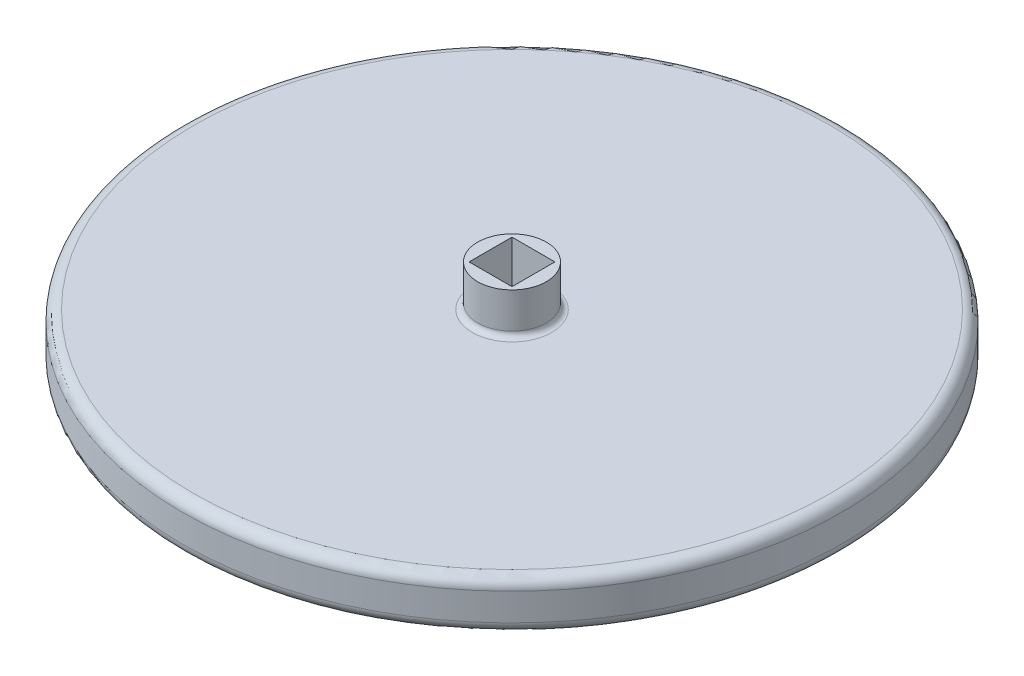
from build123d import *

# Parameters (mm, degrees)
SKETCH1_R                = 76.2
BOSS_EXTRUDE1_DEPTH      = 11.43
FILLET1_R                = 2.54
BOSS_EXTRUDE2_DEPTH      = 9.525
BOSS_EXTRUDE2_DEPTH_BACK = 20.955
SKETCH3_R                = 7.9375
FILLET2_R                = 1.27
CUT_EXTRUDE1_DEPTH       = 110.78156512
CUT_EXTRUDE1_DEPTH_BACK  = 110.78156512
SKETCH2_W                = 9.921875
SKETCH2_H                = 9.921875


with BuildPart() as part:
    # Sketch1 → Boss-Extrude1 (new body)
    with BuildSketch(Plane(origin=(0, 0, 0), x_dir=(1, 0, 0), z_dir=(0, 1, 0))):
        with Locations(Location((0, 0, 0), (0, 0, 270))):
            Circle(SKETCH1_R)
    extrude(amount=BOSS_EXTRUDE1_DEPTH)

    # Fillet1
    fillet1_edges = [part.edges().sort_by_distance(p)[0] for p in [
        (0, 0, -76.2),
        (0, 11.43, -76.2),
    ]]
    fillet(fillet1_edges, radius=FILLET1_R)

    # Sketch3 → Boss-Extrude2 (add, two sides: drawn at the far end of the back side and taken through both)
    with BuildSketch(Plane(origin=(0, 11.43, 0), x_dir=(1, 0, 0), z_dir=(0, 1, 0)).offset(-BOSS_EXTRUDE2_DEPTH_BACK)):
        with Locations(Location((0, 0, 0), (0, 0, 270))):
            Circle(SKETCH3_R)
    extrude(amount=BOSS_EXTRUDE2_DEPTH + BOSS_EXTRUDE2_DEPTH_BACK)

    # Fillet2
    fillet2_edges = [part.edges().sort_by_distance(p)[0] for p in [
        (0, 11.43, -7.9375),
        (0, 0, -7.9375),
    ]]
    fillet(fillet2_edges, radius=FILLET2_R)

    # Sketch2 → Cut-Extrude1 (cut, two sides: drawn at the far end of the back side and taken through both)
    with BuildSketch(Plane(origin=(0, 11.43, 0), x_dir=(1, 0, 0), z_dir=(0, 1, 0)).offset(-CUT_EXTRUDE1_DEPTH_BACK)):
        Rectangle(SKETCH2_W, SKETCH2_H)
    extrude(amount=CUT_EXTRUDE1_DEPTH + CUT_EXTRUDE1_DEPTH_BACK, mode=Mode.SUBTRACT)


solid = part.part
